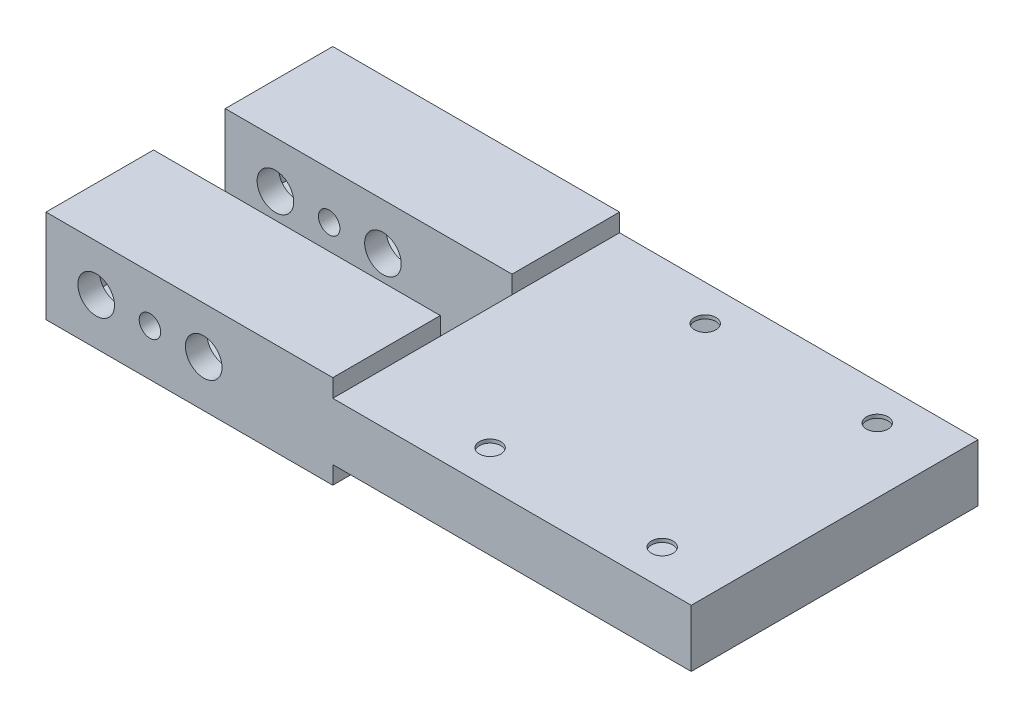
from build123d import *

# Parameters (mm, degrees)
BOSS_EXTRUDE1_DEPTH             = 5
BOSS_EXTRUDE1_DEPTH_BACK        = 5
SHELL1_T                        = -3
BOSS_EXTRUDE2_START             = 5
BOSS_EXTRUDE2_DEPTH             = 3
SKETCH2_R                       = 1.5
CUT_EXTRUDE1_DEPTH              = 100
SKETCH9_W                       = 40
SKETCH9_H                       = 2.5
CUT_EXTRUDE2_DEPTH              = 77.739820172
SKETCH10_W                      = 10
SKETCH10_H                      = 40
CUT_EXTRUDE3_DEPTH              = 2.5
CUT_EXTRUDE4_START              = -10.5
SKETCH10_2_W                    = 10
SKETCH10_2_H                    = 40
CUT_EXTRUDE4_DEPTH              = 2.5
F_3_0MM_CLEARANCE_DOWEL_HOLE1_D = 3
F_1_4_20_TAPPED_HOLE1_D         = 5.1054


with BuildPart() as part:
    # Sketch1 → Boss-Extrude1 (new, two sides: drawn at the far end of the back side and taken through both)
    with BuildSketch(Plane(origin=(0, 0, 0), x_dir=(1, 0, 0), z_dir=(0, 1, 0)).offset(-BOSS_EXTRUDE1_DEPTH_BACK)):
        Polygon((15, -5), (-25, -5), (-25, -20), (25, -20), (65, -20), (65, 20), (25, 20), (-25, 20), (-25, 5), (15, 5), align=None)
    extrude(amount=BOSS_EXTRUDE1_DEPTH + BOSS_EXTRUDE1_DEPTH_BACK)

    # Shell1
    shell1_openings = [part.faces().sort_by_distance(p)[0] for p in [
        (23.125, 5, 0),
    ]]
    offset(amount=SHELL1_T, openings=shell1_openings, kind=Kind.INTERSECTION)

    # Sketch1<2> → Boss-Extrude2 (add)
    with BuildSketch(Plane(origin=(0, 0, 0), x_dir=(1, 0, 0), z_dir=(0, 1, 0)).offset(BOSS_EXTRUDE2_START)):
        Polygon((15, -5), (-25, -5), (-25, -20), (25, -20), (65, -20), (65, 20), (25, 20), (-25, 20), (-25, 5), (15, 5), align=None)
    extrude(amount=BOSS_EXTRUDE2_DEPTH)

    # Sketch2 → Cut-Extrude1 (cut)
    with BuildSketch(Plane.XY.offset(20)):
        with Locations((-10.5, 1.5)):
            Circle(SKETCH2_R)
    extrude(amount=-CUT_EXTRUDE1_DEPTH, mode=Mode.SUBTRACT)

    # Sketch9 → Cut-Extrude2 (cut, through all)
    with BuildSketch(Plane.XY.offset(20)):
        with Locations((45, 6.75)):
            Rectangle(SKETCH9_W, SKETCH9_H)
        with Locations((45, -3.75)):
            Rectangle(SKETCH9_W, SKETCH9_H)
    extrude(amount=-CUT_EXTRUDE2_DEPTH, mode=Mode.SUBTRACT)

    # Sketch10 → Cut-Extrude3 (cut)
    with BuildSketch(Plane(origin=(0, 8, 0), x_dir=(1, 0, 0), z_dir=(0, 1, 0))):
        with Locations((20, 0)):
            Rectangle(SKETCH10_W, SKETCH10_H)
    extrude(amount=-CUT_EXTRUDE3_DEPTH, mode=Mode.SUBTRACT)

    # Sketch10<2> → Cut-Extrude4 (cut)
    with BuildSketch(Plane(origin=(0, 8, 0), x_dir=(1, 0, 0), z_dir=(0, 1, 0)).offset(CUT_EXTRUDE4_START)):
        with Locations((20, 0)):
            Rectangle(SKETCH10_2_W, SKETCH10_2_H)
    extrude(amount=-CUT_EXTRUDE4_DEPTH, mode=Mode.SUBTRACT)

    # Ø3.0mm Clearance Dowel Hole1 (through all)
    with Locations(Plane(origin=(0, 5.5, 0), x_dir=(1, 0, 0), z_dir=(0, 1, 0))):
        with Locations((31.950000364, 15), (31.950000364, -15), (55.950000364, -15), (55.950000364, 15)):
            Hole(F_3_0MM_CLEARANCE_DOWEL_HOLE1_D / 2)

    # 1/4-20 Tapped Hole1 (through all)
    with Locations(Plane.XY.offset(20)):
        with Locations((-18, 1.5), (-3, 1.5)):
            Hole(F_1_4_20_TAPPED_HOLE1_D / 2)


solid = part.part
